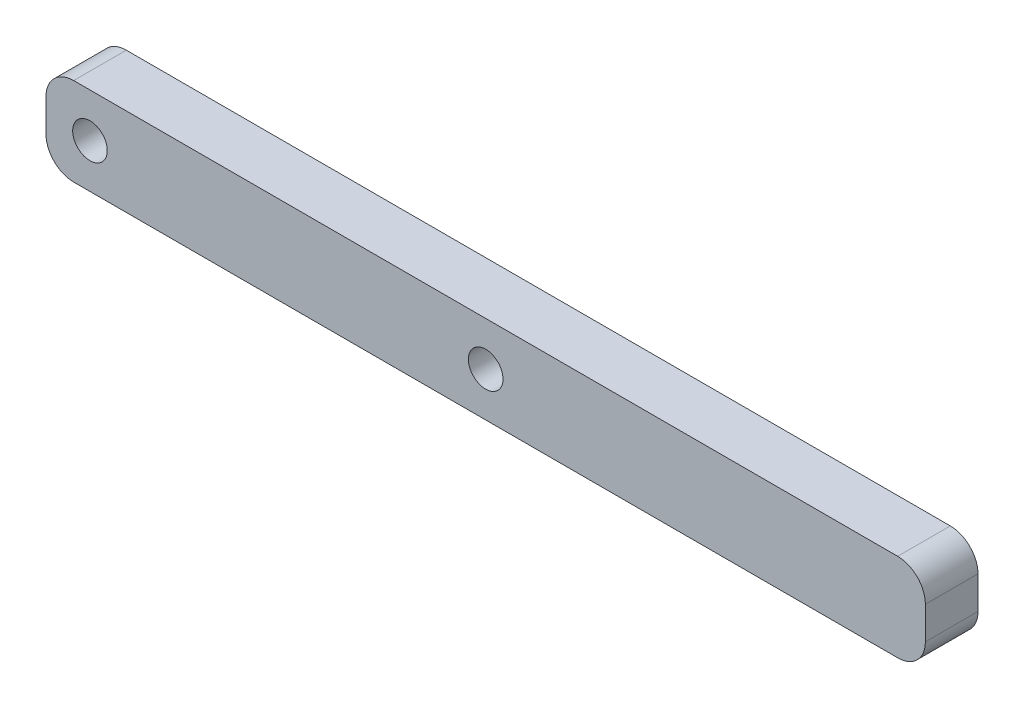
from build123d import *

# Parameters (mm, degrees)
SKETCH2_W           = 127
SKETCH2_H           = 12.7
SKETCH2_R           = 2.5
BOSS_EXTRUDE1_DEPTH = 7.6
FILLET1_R           = 4


with BuildPart() as part:
    # Sketch2 → Boss-Extrude1 (new body)
    with BuildSketch(Plane.XY):
        with Locations((-63.5, 6.35)):
            Rectangle(SKETCH2_W, SKETCH2_H)
        with Locations(Location((-120.65, 6.35, 0), (0, 0, 180))):
            Circle(SKETCH2_R, mode=Mode.SUBTRACT)
        with Locations(Location((-63.5, 6.35, 0), (0, 0, 180))):
            Circle(SKETCH2_R, mode=Mode.SUBTRACT)
    extrude(amount=BOSS_EXTRUDE1_DEPTH)

    # Fillet1
    fillet1_edges = [part.edges().sort_by_distance(p)[0] for p in [
        (-127, 12.7, 3.8),
        (0, 12.7, 3.8),
        (0, 0, 3.8),
        (-127, 0, 3.8),
    ]]
    fillet(fillet1_edges, radius=FILLET1_R)


solid = part.part
